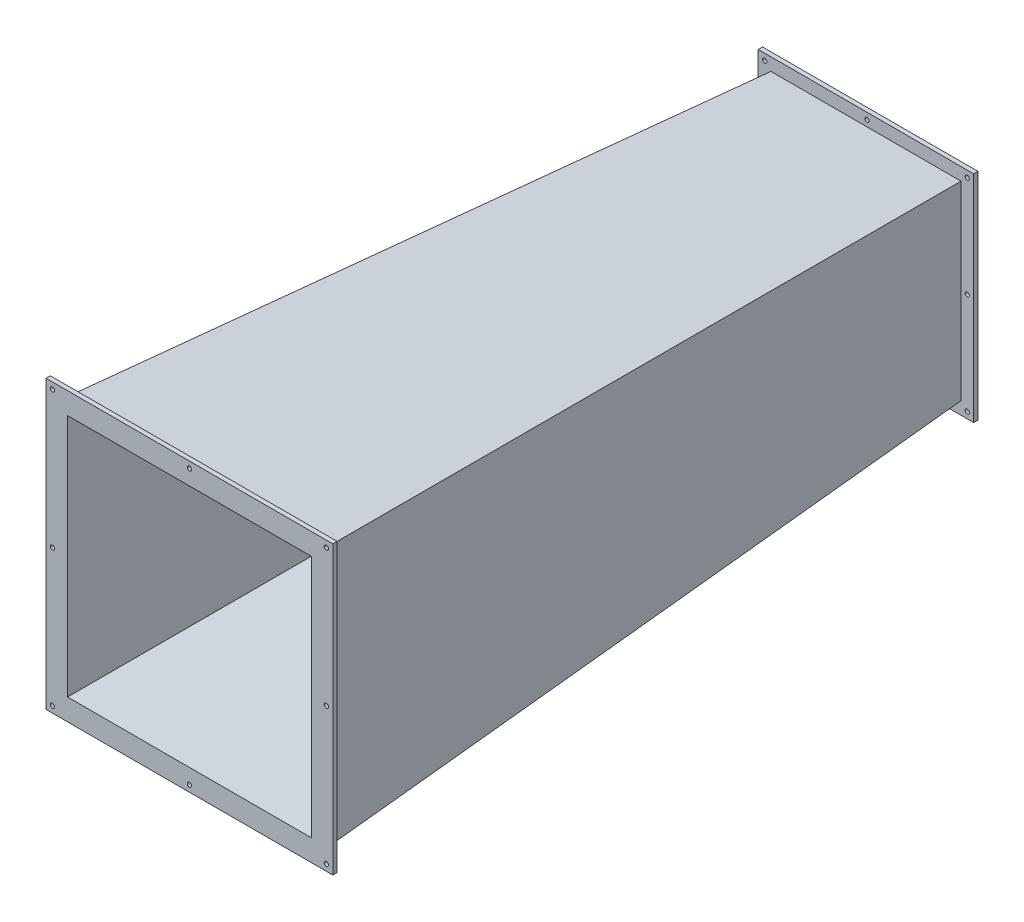
from build123d import *

# Parameters (mm, degrees)
SKETCH3_W           = 302.8427
SKETCH3_H           = 302.8427
BOSS_EXTRUDE1_DEPTH = 790
BOSS_EXTRUDE1_DRAFT = -3
SKETCH6_W           = 200
SKETCH6_H           = 200
CUT_EXTRUDE3_DEPTH  = 790
CUT_EXTRUDE3_DRAFT  = 3
SKETCH7_W           = 250
SKETCH7_H           = 250
SKETCH7_R           = 2.5
SKETCH7_W_2         = 200
SKETCH7_H_2         = 200
BOSS_EXTRUDE2_DEPTH = 5
SKETCH8_W           = 332.804291268
SKETCH8_H           = 332.804291268
SKETCH8_R           = 2.5
SKETCH8_W_2         = 282.804291268
SKETCH8_H_2         = 282.804291268
BOSS_EXTRUDE3_DEPTH = 5


with BuildPart() as part:
    # Sketch3 → Boss-Extrude1 (with draft: the straight prism first)
    with BuildSketch(Plane.XY.offset(790)):
        Rectangle(SKETCH3_W, SKETCH3_H)
    extrude(amount=-BOSS_EXTRUDE1_DEPTH)
    # Boss-Extrude1: the draft: its side faces are tilted about the plane it starts from
    boss_extrude1_sides = [part.faces().sort_by_distance(p)[0] for p in [
        (0, 151.42135, 395),
        (-151.42135, 0, 395),
        (0, -151.42135, 395),
        (151.42135, 0, 395),
    ]]
    draft(boss_extrude1_sides, Plane.XY.offset(790), BOSS_EXTRUDE1_DRAFT)


with BuildPart() as cut_extrude3_tool:
    # Sketch6 → Cut-Extrude3 (with draft: the straight prism first)
    with BuildSketch(Plane(origin=(0, 0, 0), x_dir=(-1, 0, 0), z_dir=(0, 0, -1))):
        Rectangle(SKETCH6_W, SKETCH6_H)
    extrude(amount=-CUT_EXTRUDE3_DEPTH)
    # Cut-Extrude3: the draft: its side faces are tilted about the plane it starts from
    cut_extrude3_sides = [cut_extrude3_tool.faces().sort_by_distance(p)[0] for p in [
        (0, -100, 395),
        (-100, 0, 395),
        (0, 100, 395),
        (100, 0, 395),
    ]]
    draft(cut_extrude3_sides, Plane(origin=(0, 0, 0), x_dir=(-1, 0, 0), z_dir=(0, 0, -1)), CUT_EXTRUDE3_DRAFT)


with BuildPart() as part_1:
    add(part.part)

    # Cut-Extrude3: cut by cut_extrude3_tool
    add(cut_extrude3_tool.part, mode=Mode.SUBTRACT)

    # Sketch7 → Boss-Extrude2 (add)
    with BuildSketch(Plane(origin=(0, 0, 0), x_dir=(-1, 0, 0), z_dir=(0, 0, -1))):
        Rectangle(SKETCH7_W, SKETCH7_H)
        with Locations((0, -117.5)):
            Circle(SKETCH7_R, mode=Mode.SUBTRACT)
        with Locations((-117.509602183, 117.509602183)):
            Circle(SKETCH7_R, mode=Mode.SUBTRACT)
        with Locations(Location((117.509602183, -117.509602183, 0), (0, 0, 180))):
            Circle(SKETCH7_R, mode=Mode.SUBTRACT)
        with Locations(Location((-117.5, 0, 0), (0, 0, 180))):
            Circle(SKETCH7_R, mode=Mode.SUBTRACT)
        with Locations((-117.509602183, -117.509602183)):
            Circle(SKETCH7_R, mode=Mode.SUBTRACT)
        with Locations(Location((117.509602183, 117.509602183, 0), (0, 0, 180))):
            Circle(SKETCH7_R, mode=Mode.SUBTRACT)
        with Locations((117.5, 0)):
            Circle(SKETCH7_R, mode=Mode.SUBTRACT)
        with Locations((-1.21803637, 117.509602183)):
            Circle(SKETCH7_R, mode=Mode.SUBTRACT)
        Rectangle(SKETCH7_W_2, SKETCH7_H_2, mode=Mode.SUBTRACT)
    extrude(amount=-BOSS_EXTRUDE2_DEPTH)

    # Sketch8 → Boss-Extrude3 (add)
    with BuildSketch(Plane.XY.offset(790)):
        Rectangle(SKETCH8_W, SKETCH8_H)
        with Locations((-158.911747817, 0)):
            Circle(SKETCH8_R, mode=Mode.SUBTRACT)
        with Locations((-158.911747817, 158.911747817)):
            Circle(SKETCH8_R, mode=Mode.SUBTRACT)
        with Locations(Location((158.911747817, -158.911747817, 0), (0, 0, 180))):
            Circle(SKETCH8_R, mode=Mode.SUBTRACT)
        with Locations(Location((0, -158.911747817, 0), (0, 0, 180))):
            Circle(SKETCH8_R, mode=Mode.SUBTRACT)
        with Locations((158.911747817, 158.911747817)):
            Circle(SKETCH8_R, mode=Mode.SUBTRACT)
        with Locations((0, 158.911747817)):
            Circle(SKETCH8_R, mode=Mode.SUBTRACT)
        with Locations(Location((-158.911747817, -158.911747817, 0), (0, 0, 180))):
            Circle(SKETCH8_R, mode=Mode.SUBTRACT)
        with Locations((158.911747817, 0)):
            Circle(SKETCH8_R, mode=Mode.SUBTRACT)
        Rectangle(SKETCH8_W_2, SKETCH8_H_2, mode=Mode.SUBTRACT)
    extrude(amount=-BOSS_EXTRUDE3_DEPTH)


solid = part_1.part
